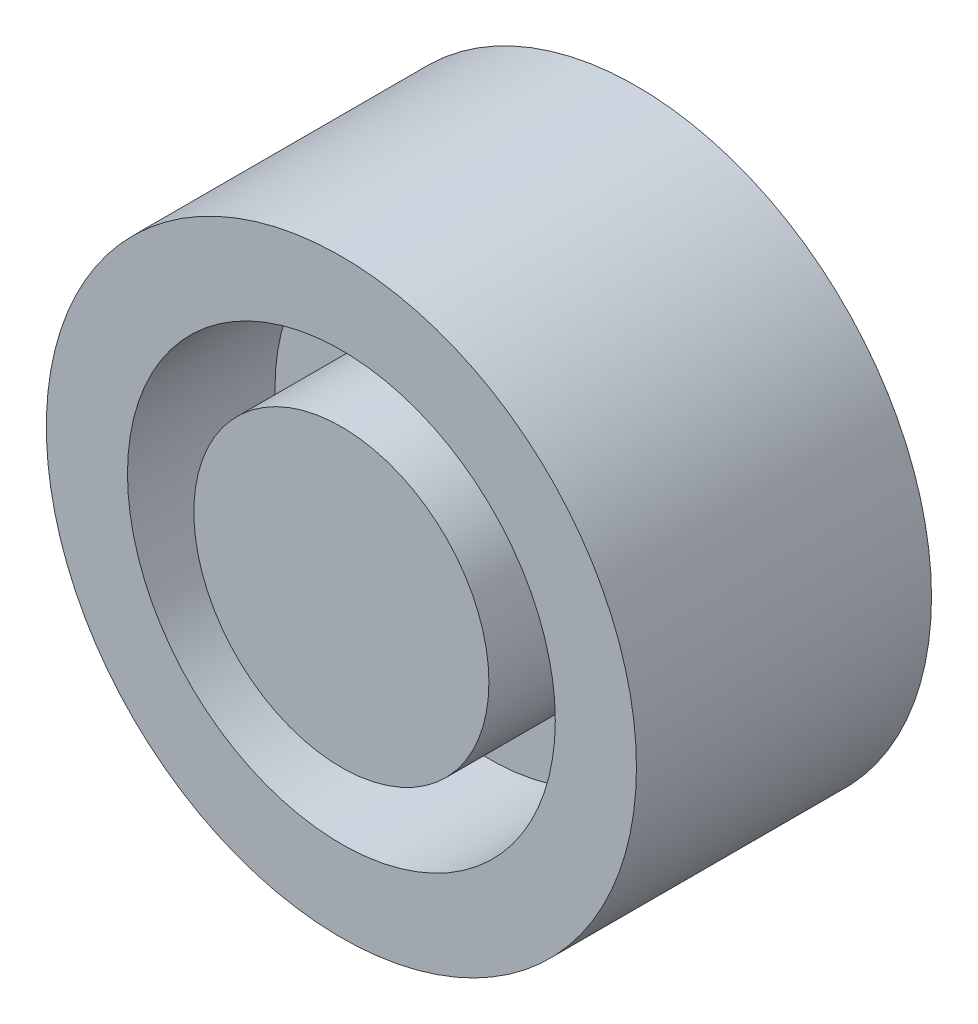
from build123d import *

# Parameters (mm, degrees)
SKETCH1_R           = 2
BOSS_EXTRUDE1_DEPTH = 2
SKETCH2_R           = 1.45
SKETCH2_R_2         = 1
CUT_EXTRUDE1_DEPTH  = 1


with BuildPart() as part:
    # Sketch1 → Boss-Extrude1 (new body)
    with BuildSketch(Plane.XY):
        Circle(SKETCH1_R)
    extrude(amount=BOSS_EXTRUDE1_DEPTH)

    # Sketch2 → Cut-Extrude1 (cut)
    with BuildSketch(Plane.XY.offset(2)):
        Circle(SKETCH2_R)
        Circle(SKETCH2_R_2, mode=Mode.SUBTRACT)
    extrude(amount=-CUT_EXTRUDE1_DEPTH, mode=Mode.SUBTRACT)


solid = part.part
